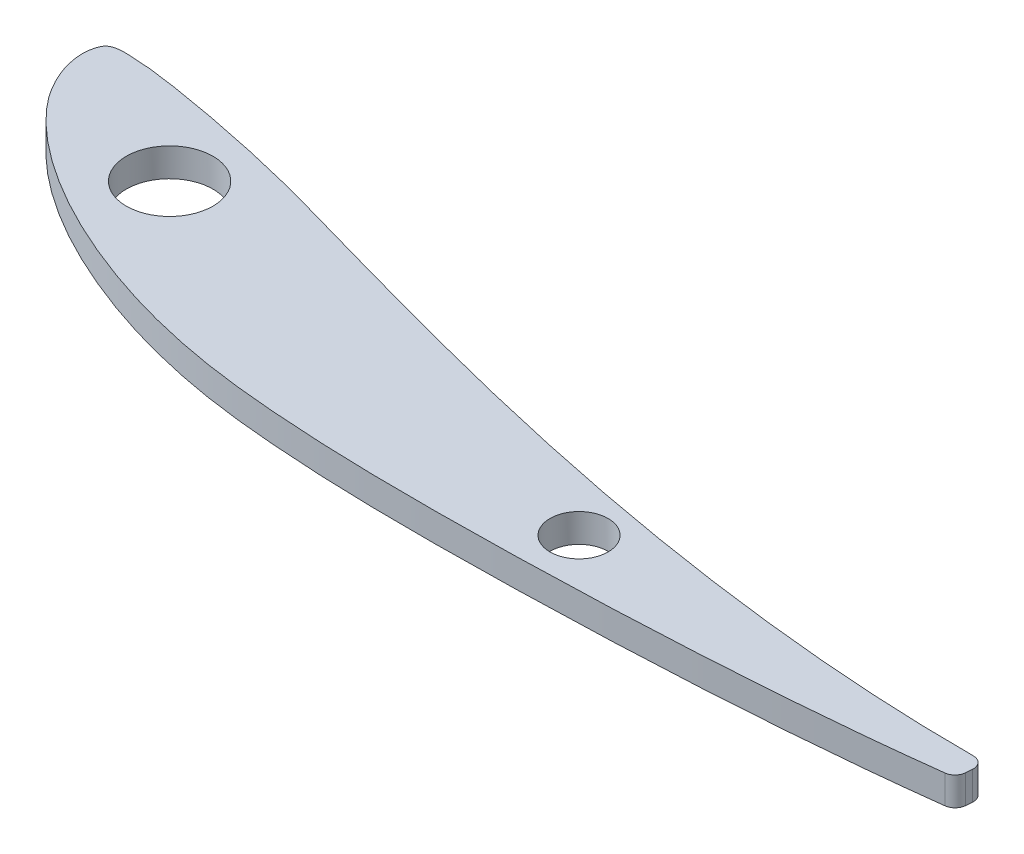
from build123d import *

# Parameters (mm, degrees)
BOSS_EXTRUDE1_DEPTH      = 3.175
BOSS_EXTRUDE1_DEPTH_BACK = 3.175
CUT_EXTRUDE2_DEPTH       = 304.054907492
FILLET1_R                = 2.54
CUT_EXTRUDE3_DEPTH       = 243.699020372
CUT_EXTRUDE3_DEPTH_BACK  = 243.699020372
SKETCH7_R                = 9.652
SKETCH7_R_2              = 6.477


with BuildPart() as part:
    # Sketch1 → Boss-Extrude1 (new, two sides: drawn at the far end of the back side and taken through both)
    with BuildSketch(Plane(origin=(0, 0, 0), x_dir=(1, 0, 0), z_dir=(0, 1, 0)).offset(-BOSS_EXTRUDE1_DEPTH_BACK)):
        with BuildLine():
            add(Edge.make_bspline(
                [(298.857811711, -26.146670531), (298.856662639, -26.138748613), (297.633641764, -26.821990776), (296.285509349, -27.484830329), (292.777465742, -29.195545242), (288.067262994, -30.965858612), (281.523729362, -32.778663959), (273.586904679, -34.319819612), (264.347464535, -35.601306185), (253.981328037, -36.534778925), (242.613491301, -37.069613637), (230.394070319, -37.174628944), (217.471223612, -36.817831575), (204.000404991, -36.002841721), (190.136234507, -34.734731771), (176.033094201, -33.031028977), (161.84217789, -30.93087735), (147.709569871, -28.481169952), (133.775408695, -25.725834014), (120.166596155, -22.745112557), (107.002388598, -19.601658781), (94.391389019, -16.378168068), (82.426724302, -13.153699812), (71.190567594, -10.017296863), (60.746921668, -7.064077701), (51.143228223, -4.349858186), (42.312118233, -2.083201617), (34.206010598, -0.305666429), (26.845350389, 1.171038744), (20.267932508, 2.361544083), (14.540399058, 3.24605787), (9.731727013, 3.874816717), (5.881761395, 4.074290494), (3.063913135, 4.179501809), (0.890615185, 3.368572706), (0.154946108, 1.417572767), (-0.130342445, -0.754680536), (0.138551363, -3.375901528), (0.930948931, -6.259459446), (2.290772789, -9.342303853), (4.215217109, -12.557025667), (6.80111556, -15.818066448), (10.037189197, -19.098154092), (13.869918762, -22.425351248), (18.303103076, -25.736544319), (23.310782657, -28.989836524), (28.867159146, -32.15094599), (34.958371438, -35.16431572), (41.546384136, -38.01333054), (48.606943214, -40.642677735), (56.112522694, -43.014286243), (64.06349617, -45.032945657), (72.461501008, -46.702374781), (81.348555495, -47.939494241), (90.724896642, -48.78156918), (100.557655285, -49.403507495), (110.80081361, -49.752158376), (121.392265755, -49.884335009), (132.268244943, -49.836744442), (143.348018682, -49.658374813), (154.540276146, -49.36267816), (165.750498467, -48.973488798), (176.890849421, -48.473480024), (187.88115368, -47.860371695), (198.650770602, -47.140456047), (209.131260407, -46.304530769), (219.261147011, -45.369763216), (228.977405871, -44.33325801), (238.222197521, -43.213148769), (246.939229806, -42.014429751), (255.076498669, -40.744800989), (262.587093356, -39.41449849), (269.428915294, -38.038077862), (275.563806788, -36.621472552), (280.959330362, -35.178797057), (285.589917421, -33.721336157), (289.446513886, -32.274213265), (292.583014342, -30.707507147), (294.917442259, -29.085711876), (296.910747695, -27.543670003), (297.812683676, -26.800824947), (298.858937887, -26.154434606), (298.857811711, -26.146670531)],
                knots=[0, 0, 0, 0, 0.000999594, 0.004147435, 0.009748209, 0.018044377, 0.028864178, 0.04183079, 0.056713807, 0.073341232, 0.091507989, 0.111021837, 0.131661709, 0.153207715, 0.175433402, 0.198110317, 0.221011446, 0.243905882, 0.266573311, 0.288810349, 0.310405036, 0.331177743, 0.350943876, 0.3695564, 0.386864963, 0.402753039, 0.417195876, 0.430379519, 0.442362633, 0.453032156, 0.462284346, 0.470026206, 0.476176645, 0.480649947, 0.483553073, 0.486420689, 0.489953231, 0.494096927, 0.498850588, 0.50419675, 0.510125492, 0.516691031, 0.524011699, 0.532092122, 0.540897921, 0.550403414, 0.560581041, 0.571396483, 0.582828081, 0.594829641, 0.607347037, 0.620384325, 0.633968937, 0.648199967, 0.663193937, 0.678898581, 0.695226562, 0.712113221, 0.729459406, 0.747143117, 0.765009772, 0.782904928, 0.800688045, 0.818242105, 0.835449083, 0.852211621, 0.868429578, 0.884009363, 0.898854951, 0.912881827, 0.92601075, 0.938166771, 0.949289699, 0.959322172, 0.968216949, 0.97594822, 0.982474409, 0.987904723, 0.992516501, 0.996351138, 0.999020322, 1, 1, 1, 1], degree=3))
        make_face()
    extrude(amount=BOSS_EXTRUDE1_DEPTH + BOSS_EXTRUDE1_DEPTH_BACK)

    # Sketch6 → Cut-Extrude2 (cut, through all)
    with BuildSketch(Plane(origin=(0, 3.175, 0), x_dir=(1, 0, 0), z_dir=(0, 1, 0))):
        Polygon((231.503607586, -107.587328596), (246.668891151, 65.752655747), (509.973758465, 42.716464806), (494.808474899, -130.623519537), align=None)
    extrude(amount=-CUT_EXTRUDE2_DEPTH, mode=Mode.SUBTRACT)

    # Fillet1
    fillet1_edges = [part.edges().sort_by_distance(p)[0] for p in [
        (237.125456767, 1.5875, 43.329298412),
        (237.671224754, -1.5874997, 37.091141783),
    ]]
    fillet(fillet1_edges, radius=FILLET1_R)

    # Sketch7 → Cut-Extrude3 (cut, two sides: drawn at the far end of the back side and taken through both)
    with BuildSketch(Plane(origin=(0, 3.175, 0), x_dir=(1, 0, 0), z_dir=(0, 1, 0)).offset(-CUT_EXTRUDE3_DEPTH_BACK)):
        with Locations((34.317805531, -15.750930878)):
            Circle(SKETCH7_R)
        with Locations((148.341148857, -38.475192733)):
            Circle(SKETCH7_R_2)
    extrude(amount=CUT_EXTRUDE3_DEPTH + CUT_EXTRUDE3_DEPTH_BACK, mode=Mode.SUBTRACT)


solid = part.part
